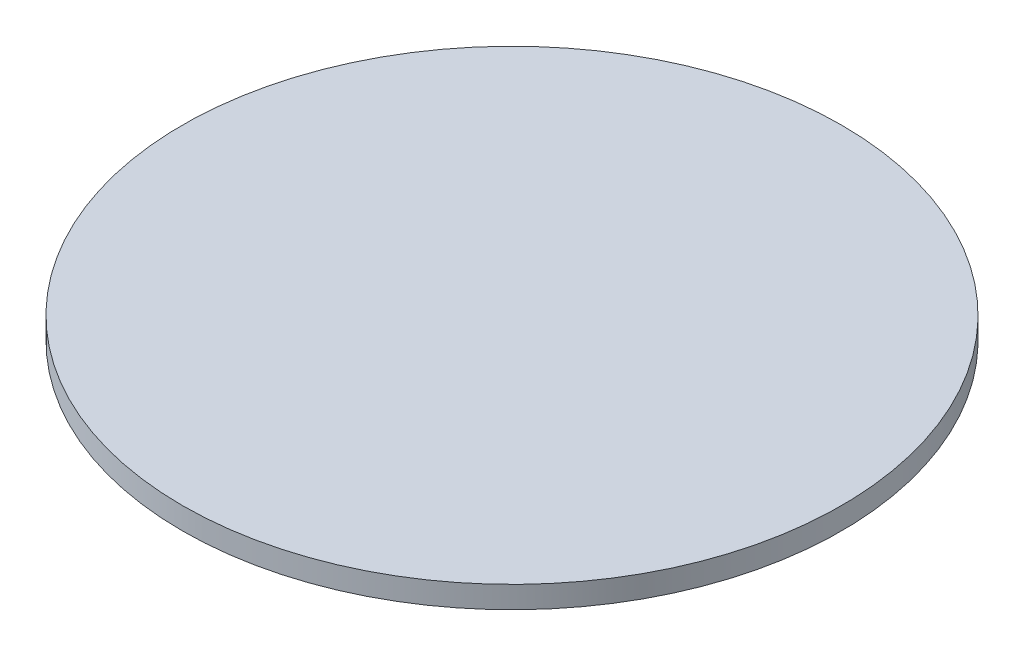
from build123d import *

# Parameters (mm, degrees)
SKETCH_3_R      = 150
EXTRUDE_2_DEPTH = 10


with BuildPart() as part:
    # ｽｹｯﾁ3 → ﾎﾞｽ - 押し出し2 (new body)
    with BuildSketch(Plane(origin=(0, 0, 0), x_dir=(1, 0, 0), z_dir=(0, 1, 0))):
        with Locations(Location((0, 0, 0), (0, 0, 270))):
            Circle(SKETCH_3_R)
    extrude(amount=EXTRUDE_2_DEPTH)


solid = part.part
